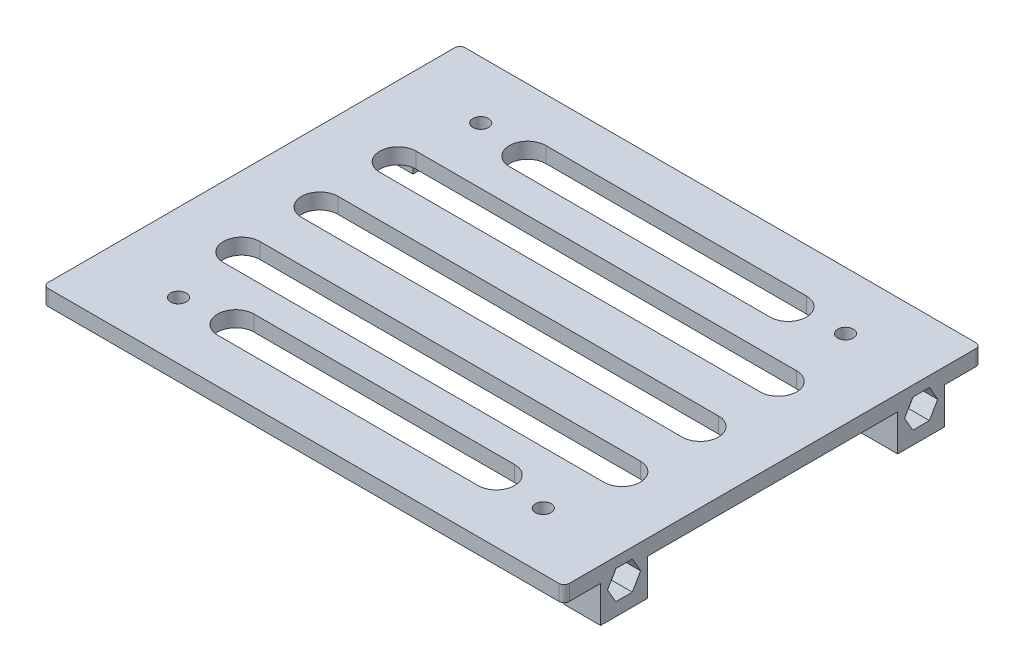
from build123d import *

# Parameters (mm, degrees)
EXTRUDE_1_DEPTH                            = 10
CUT_EXTRUDE_1_DEPTH                        = 7
CUT_EXTRUDE_3_DEPTH                        = 4
CUT_EXTRUDE_4_DEPTH                        = 65.412731661
CUT_EXTRUDE_6_REACH                        = 106.48
SKETCH_8_R                                 = 1.5
CUT_EXTRUDE_6_DIRECTION_2_DEPTH            = 105.479663093
MIRROR_2_AT_THE_SECOND_PLANE_COPY_1_REACH  = 106.48
MIRROR_2_AT_THE_SECOND_PLANE_COPY_1_SKET_R = 1.5
MIRROR_2_AT_THE_SECOND_PLANE_COPY_2_SKET_R = 1.5
MIRROR_2_AT_THE_SECOND_PLANE_COPY_2_DEPTH  = 105.479663093
MIRROR_2_AT_THE_SECOND_PLANE_COPY_3_SKET_R = 1.5
MIRROR_2_AT_THE_SECOND_PLANE_COPY_3_DEPTH  = 105.479663093
CUT_EXTRUDE_7_REACH                        = 66.413
SKETCH_9_R                                 = 1.5
MIRROR_3_AT_THE_SECOND_PLANE_COPY_1_REACH  = 66.413
MIRROR_3_AT_THE_SECOND_PLANE_COPY_1_SKET_R = 1.5


with BuildPart() as part:
    # 草图1 → 凸台-拉伸1 (new body)
    with BuildSketch(Plane(origin=(0, 0, 0), x_dir=(1, 0, 0), z_dir=(0, 1, 0))):
        with BuildLine():
            Line((-49, 40), (49, 40))
            ThreePointArc((49, 40), (49.707106781, 39.707106781), (50, 39))
            Line((50, 39), (50, -39))
            ThreePointArc((50, -39), (49.707106781, -39.707106781), (49, -40))
            Line((49, -40), (-49, -40))
            ThreePointArc((-49, -40), (-49.707106781, -39.707106781), (-50, -39))
            Line((-50, -39), (-50, 39))
            ThreePointArc((-50, 39), (-49.707106781, 39.707106781), (-49, 40))
        make_face()
    extrude(amount=EXTRUDE_1_DEPTH)

    # 草图2 → 切除-拉伸1 (cut)
    with BuildSketch(Plane(origin=(0, 0, 0), x_dir=(-1, 0, 0), z_dir=(0, -1, 0))):
        Polygon((-50, 33), (-43, 33), (-43, 24), (-50, 24), (-50, -24), (-43, -24), (-43, -33), (-50, -33), (-50, -40), (50, -40), (50, -33), (43, -33), (43, -24), (50, -24), (50, 24), (43, 24), (43, 33), (50, 33), (50, 40), (-50, 40), align=None)
    extrude(amount=-CUT_EXTRUDE_1_DEPTH, mode=Mode.SUBTRACT)

    # 草图5 → 切除-拉伸3 (cut)
    with BuildSketch(Plane.ZY.offset(50)):
        Polygon((30.08771324, 7.998490707), (31.675426481, 5.248490707), (30.08771324, 2.498490707), (26.91228676, 2.498490707), (25.324573519, 5.248490707), (26.91228676, 7.998490707), align=None)
        Polygon((-25.324573519, 5.248490707), (-26.91228676, 7.998490707), (-30.08771324, 7.998490707), (-31.675426481, 5.248490707), (-30.08771324, 2.498490707), (-26.91228676, 2.498490707), align=None)
    cut_extrude_3 = extrude(amount=-CUT_EXTRUDE_3_DEPTH, mode=Mode.SUBTRACT)

    # 镜向1: 切除-拉伸3 across plane
    add(cut_extrude_3.mirror(Plane(origin=(0, 0, 0), x_dir=(0, 0, 1), z_dir=(1, 0, 0))), mode=Mode.SUBTRACT)

    # 草图6 → 切除-拉伸4 (cut, through all)
    with BuildSketch(Plane(origin=(0, 7, 0), x_dir=(-1, 0, 0), z_dir=(0, -1, 0))):
        with BuildLine():
            Line((25, -31.5), (-25, -31.5))
            ThreePointArc((-25, -31.5), (-28.5, -28), (-25, -24.5))
            Line((-25, -24.5), (25, -24.5))
            ThreePointArc((25, -24.5), (28.5, -28), (25, -31.5))
        make_face()
        with BuildLine():
            Line((25, 31.5), (-25, 31.5))
            ThreePointArc((-25, 31.5), (-28.5, 28), (-25, 24.5))
            Line((-25, 24.5), (25, 24.5))
            ThreePointArc((25, 24.5), (28.5, 28), (25, 31.5))
        make_face()
        with BuildLine():
            Line((-36.5, -11.876137074), (36.5, -11.876137074))
            ThreePointArc((36.5, -11.876137074), (40, -15.376137074), (36.5, -18.876137074))
            Line((36.5, -18.876137074), (-36.5, -18.876137074))
            ThreePointArc((-36.5, -18.876137074), (-40, -15.376137074), (-36.5, -11.876137074))
        make_face()
        with BuildLine():
            Line((-36.5, 3.123862926), (36.5, 3.123862926))
            ThreePointArc((36.5, 3.123862926), (40, -0.376137074), (36.5, -3.876137074))
            Line((36.5, -3.876137074), (-36.5, -3.876137074))
            ThreePointArc((-36.5, -3.876137074), (-40, -0.376137074), (-36.5, 3.123862926))
        make_face()
        with BuildLine():
            Line((-36.5, 18.123862926), (36.5, 18.123862926))
            ThreePointArc((36.5, 18.123862926), (40, 14.623862926), (36.5, 11.123862926))
            Line((36.5, 11.123862926), (-36.5, 11.123862926))
            ThreePointArc((-36.5, 11.123862926), (-40, 14.623862926), (-36.5, 18.123862926))
        make_face()
    extrude(amount=-CUT_EXTRUDE_4_DEPTH, mode=Mode.SUBTRACT)

    # 草图8 → 切除-拉伸6 (cut, up to next)
    with BuildSketch(Plane.ZY.offset(46), mode=Mode.PRIVATE) as cut_extrude_6_sk1:
        with Locations((-28.5, 5.248490707)):
            Circle(SKETCH_8_R)
    cut_extrude_6_tool1 = extrude(cut_extrude_6_sk1.sketch, amount=-CUT_EXTRUDE_6_REACH, mode=Mode.PRIVATE) & part.part
    cut_extrude_6 = cut_extrude_6_tool1.solids().sort_by_distance((-46, 5.248491, -28.5))[0]
    add(cut_extrude_6, mode=Mode.SUBTRACT)

    # 草图8 → 切除-拉伸6 direction 2 (cut)
    with BuildSketch(Plane.ZY.offset(46)):
        with Locations((-28.5, 5.248490707)):
            Circle(SKETCH_8_R)
    cut_extrude_6_direction_2 = extrude(amount=CUT_EXTRUDE_6_DIRECTION_2_DEPTH, mode=Mode.SUBTRACT)

    # 镜向2: 切除-拉伸6, 切除-拉伸6 direction 2 across plane
    add(cut_extrude_6.mirror(Plane(origin=(0, 0, 0), x_dir=(0, 0, 1), z_dir=(1, 0, 0))), mode=Mode.SUBTRACT)
    add(cut_extrude_6_direction_2.mirror(Plane(origin=(0, 0, 0), x_dir=(0, 0, 1), z_dir=(1, 0, 0))), mode=Mode.SUBTRACT)

    # 镜向2 at the second plane: 切除-拉伸6, 切除-拉伸6 direction 2 across plane
    add(cut_extrude_6.mirror(Plane.XY), mode=Mode.SUBTRACT)
    add(cut_extrude_6_direction_2.mirror(Plane.XY), mode=Mode.SUBTRACT)

    # 镜向2 at the second plane copy 1 sket → 镜向2 at the second plane copy 1 (cut, up to next)
    with BuildSketch(Plane(origin=(46, 0, 0), x_dir=(0, 0, -1), z_dir=(1, 0, 0)), mode=Mode.PRIVATE) as mirror_2_at_the_second_plane_copy_1_sk1:
        with Locations((-28.5, 5.248490707)):
            Circle(MIRROR_2_AT_THE_SECOND_PLANE_COPY_1_SKET_R)
    mirror_2_at_the_second_plane_copy_1_tool1 = extrude(mirror_2_at_the_second_plane_copy_1_sk1.sketch, amount=-MIRROR_2_AT_THE_SECOND_PLANE_COPY_1_REACH, mode=Mode.PRIVATE) & part.part
    add(mirror_2_at_the_second_plane_copy_1_tool1.solids().sort_by_distance((46, 5.248491, 28.5))[0], mode=Mode.SUBTRACT)

    # 镜向2 at the second plane copy 2 sket → 镜向2 at the second plane copy 2 (cut)
    with BuildSketch(Plane(origin=(46, 0, 0), x_dir=(0, 0, -1), z_dir=(1, 0, 0))):
        with Locations((-28.5, 5.248490707)):
            Circle(MIRROR_2_AT_THE_SECOND_PLANE_COPY_2_SKET_R)
    extrude(amount=MIRROR_2_AT_THE_SECOND_PLANE_COPY_2_DEPTH, mode=Mode.SUBTRACT)

    # 镜向2 at the second plane copy 3 sket → 镜向2 at the second plane copy 3 (cut)
    with BuildSketch(Plane(origin=(-46, 0, 0), x_dir=(0, 0, -1), z_dir=(-1, 0, 0))):
        with Locations((-28.5, -5.248490707)):
            Circle(MIRROR_2_AT_THE_SECOND_PLANE_COPY_3_SKET_R)
    extrude(amount=MIRROR_2_AT_THE_SECOND_PLANE_COPY_3_DEPTH, mode=Mode.SUBTRACT)

    # 草图9 → 切除-拉伸7 (cut, up to next)
    with BuildSketch(Plane(origin=(0, 7, 0), x_dir=(-1, 0, 0), z_dir=(0, -1, 0)), mode=Mode.PRIVATE) as cut_extrude_7_sk1:
        with Locations(Location((35, -29, 0), (0, 0, 90))):
            Circle(SKETCH_9_R)
    cut_extrude_7_tool1 = extrude(cut_extrude_7_sk1.sketch, amount=-CUT_EXTRUDE_7_REACH, mode=Mode.PRIVATE) & part.part
    cut_extrude_7 = cut_extrude_7_tool1.solids().sort_by_distance((-35, 7, 29))[0]
    add(cut_extrude_7, mode=Mode.SUBTRACT)

    # 镜向3: 切除-拉伸7 across plane
    add(cut_extrude_7.mirror(Plane.XY), mode=Mode.SUBTRACT)

    # 镜向3 at the second plane: 切除-拉伸7 across plane
    add(cut_extrude_7.mirror(Plane(origin=(0, 0, 0), x_dir=(0, 0, 1), z_dir=(1, 0, 0))), mode=Mode.SUBTRACT)

    # 镜向3 at the second plane copy 1 sket → 镜向3 at the second plane copy 1 (cut, up to next)
    with BuildSketch(Plane.XZ.offset(-7), mode=Mode.PRIVATE) as mirror_3_at_the_second_plane_copy_1_sk1:
        with Locations(Location((35, -29, 0), (0, 0, 90))):
            Circle(MIRROR_3_AT_THE_SECOND_PLANE_COPY_1_SKET_R)
    mirror_3_at_the_second_plane_copy_1_tool1 = extrude(mirror_3_at_the_second_plane_copy_1_sk1.sketch, amount=-MIRROR_3_AT_THE_SECOND_PLANE_COPY_1_REACH, mode=Mode.PRIVATE) & part.part
    add(mirror_3_at_the_second_plane_copy_1_tool1.solids().sort_by_distance((35, 7, -29))[0], mode=Mode.SUBTRACT)


solid = part.part
